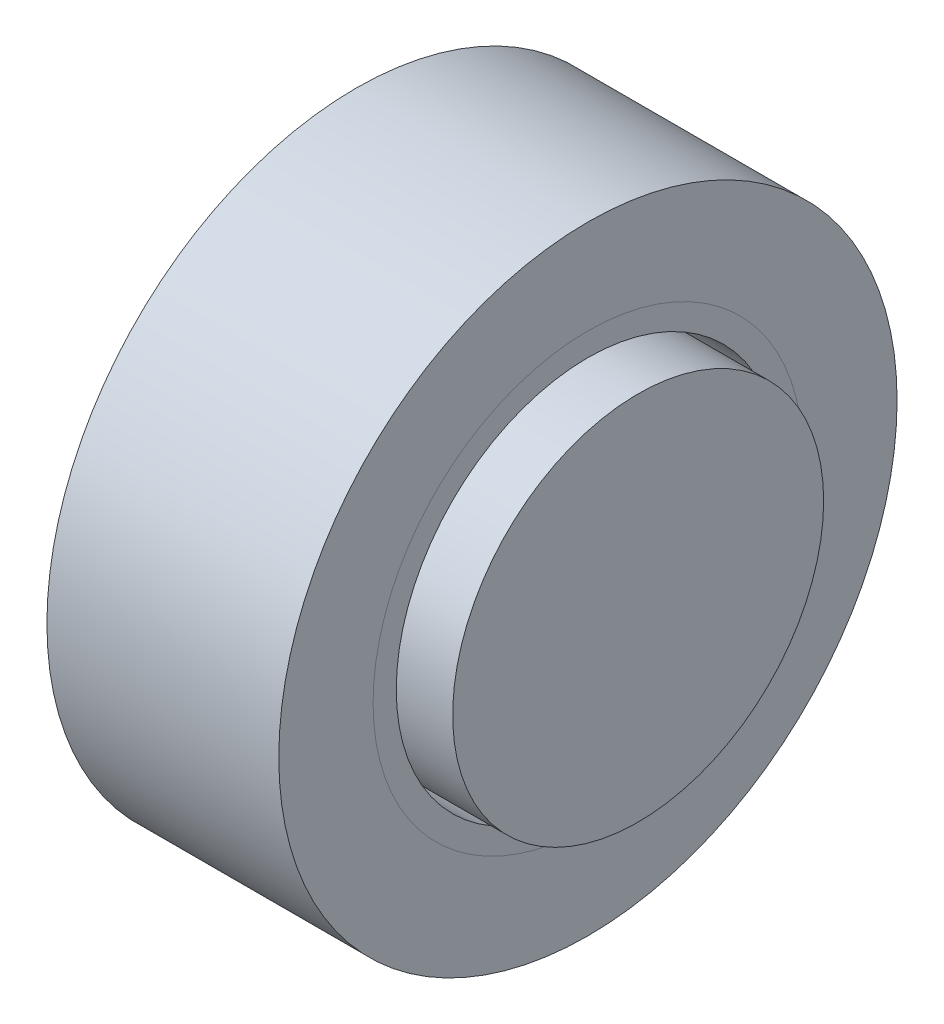
from build123d import *

# Parameters (mm, degrees)
SKETCH1_R      = 27.8
CUPFLOOR_DEPTH = 4.5
CUPWALL_START  = 4.5
SKETCH2_R      = 27.8
SKETCH2_R_2    = 24.8
CUPWALL_DEPTH  = 25.5
MOTOR_START    = 4.5
SKETCH3_R      = 24
MOTOR_DEPTH    = 32
SKETCH4_R      = 40
SKETCH4_R_2    = 27.8
FOAM_DEPTH     = 30


with BuildPart() as part:
    # Sketch1 → CupFloor (new body)
    with BuildSketch(Plane(origin=(0, 0, 0), x_dir=(0, 0, -1), z_dir=(1, 0, 0))):
        Circle(SKETCH1_R)
    extrude(amount=CUPFLOOR_DEPTH)


with BuildPart() as body_2:
    # Sketch2 → CupWall (new body)
    with BuildSketch(Plane(origin=(0, 0, 0), x_dir=(0, 0, -1), z_dir=(1, 0, 0)).offset(CUPWALL_START)):
        Circle(SKETCH2_R)
        Circle(SKETCH2_R_2, mode=Mode.SUBTRACT)
    extrude(amount=CUPWALL_DEPTH)


with BuildPart() as body_3:
    # Sketch3 → Motor (new body)
    with BuildSketch(Plane(origin=(0, 0, 0), x_dir=(0, 0, -1), z_dir=(1, 0, 0)).offset(MOTOR_START)):
        Circle(SKETCH3_R)
    extrude(amount=MOTOR_DEPTH)


with BuildPart() as body_4:
    # Sketch4 → Foam (new body)
    with BuildSketch(Plane(origin=(0, 0, 0), x_dir=(0, 0, -1), z_dir=(1, 0, 0))):
        Circle(SKETCH4_R)
        Circle(SKETCH4_R_2, mode=Mode.SUBTRACT)
    extrude(amount=FOAM_DEPTH)


solid = Compound([part.part, body_2.part, body_3.part, body_4.part])
